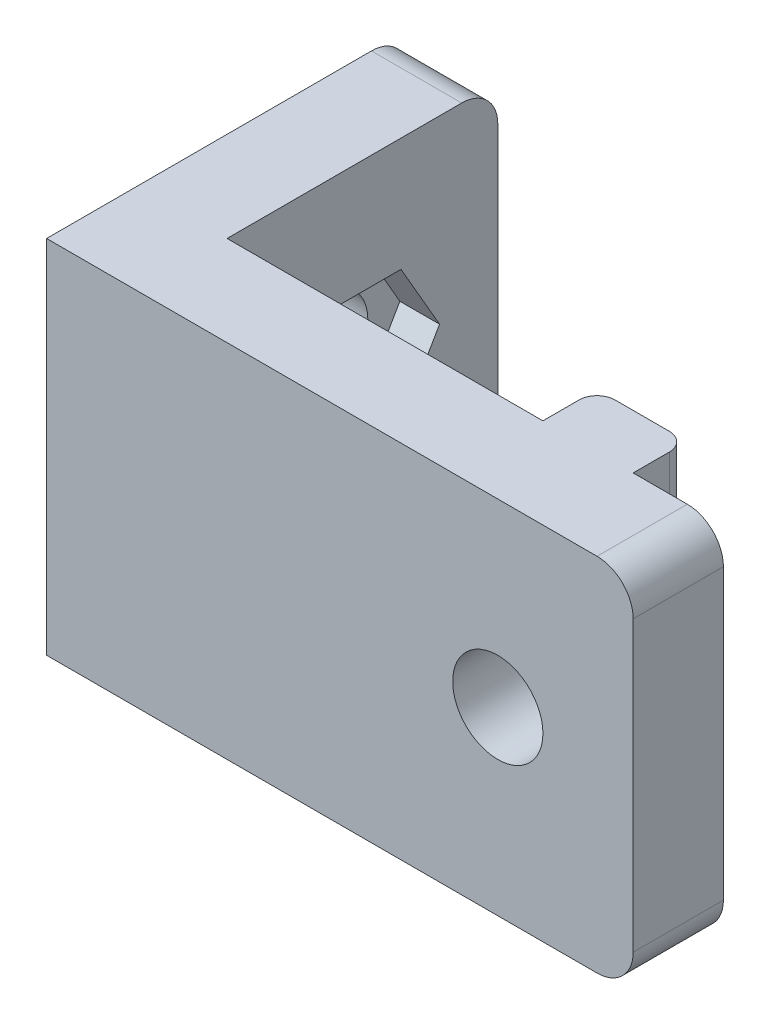
from build123d import *

# Parameters (mm, degrees)
SKETCH1_W           = 32.5
SKETCH1_H           = 20
BOSS_EXTRUDE1_DEPTH = 5
SKETCH2_W           = 5
SKETCH2_H           = 20
BOSS_EXTRUDE2_DEPTH = 15
SKETCH3_R           = 2.5
CUT_EXTRUDE1_DEPTH  = 15
SKETCH4_R           = 2.5
CUT_EXTRUDE2_DEPTH  = 15
SKETCH5_W           = 5
SKETCH5_H           = 4
BOSS_EXTRUDE3_DEPTH = 3
FILLET1_R           = 1
FILLET2_R           = 2
CUT_EXTRUDE3_DEPTH  = 2.2


with BuildPart() as part:
    # Sketch1 → Boss-Extrude1 (new body)
    with BuildSketch(Plane.XY):
        Rectangle(SKETCH1_W, SKETCH1_H)
    extrude(amount=BOSS_EXTRUDE1_DEPTH)

    # Sketch2 → Boss-Extrude2 (add)
    with BuildSketch(Plane(origin=(0, 0, 0), x_dir=(-1, 0, 0), z_dir=(0, 0, -1))):
        with Locations((13.75, 0)):
            Rectangle(SKETCH2_W, SKETCH2_H)
    extrude(amount=BOSS_EXTRUDE2_DEPTH)

    # Sketch3 → Cut-Extrude1 (cut)
    with BuildSketch(Plane(origin=(-11.25, 0, 0), x_dir=(0, 0, -1), z_dir=(1, 0, 0))):
        with Locations(Location((7.5, 0, 0), (0, 0, 90))):
            Circle(SKETCH3_R)
    extrude(amount=-CUT_EXTRUDE1_DEPTH, mode=Mode.SUBTRACT)

    # Sketch4 → Cut-Extrude2 (cut)
    with BuildSketch(Plane.XY.offset(5)):
        with Locations((8.75, 0)):
            Circle(SKETCH4_R)
    extrude(amount=-CUT_EXTRUDE2_DEPTH, mode=Mode.SUBTRACT)

    # Sketch5 → Boss-Extrude3 (add)
    with BuildSketch(Plane(origin=(0, 0, 0), x_dir=(-1, 0, 0), z_dir=(0, 0, -1))):
        with Locations((-8.75, 8)):
            Rectangle(SKETCH5_W, SKETCH5_H)
        with Locations((-8.75, -8)):
            Rectangle(SKETCH5_W, SKETCH5_H)
    extrude(amount=BOSS_EXTRUDE3_DEPTH)

    # Fillet1
    fillet1_edges = [part.edges().sort_by_distance(p)[0] for p in [
        (11.25, 8, -3),
        (6.25, 8, -3),
        (6.25, -8, -3),
        (11.25, -8, -3),
    ]]
    fillet(fillet1_edges, radius=FILLET1_R)

    # Fillet2
    fillet2_edges = [part.edges().sort_by_distance(p)[0] for p in [
        (-13.75, 10, -15),
        (-13.75, -10, -15),
        (16.25, 10, 2.5),
        (16.25, -10, 2.5),
    ]]
    fillet(fillet2_edges, radius=FILLET2_R)

    # Sketch6 → Cut-Extrude3 (cut)
    with BuildSketch(Plane(origin=(-11.25, 0, 0), x_dir=(0, 0, -1), z_dir=(1, 0, 0))):
        Polygon((3.227608008, 0), (5.363804004, -3.7), (9.636195996, -3.7), (11.772391992, 0), (9.636195996, 3.7), (5.363804004, 3.7), align=None)
    extrude(amount=-CUT_EXTRUDE3_DEPTH, mode=Mode.SUBTRACT)


solid = part.part
